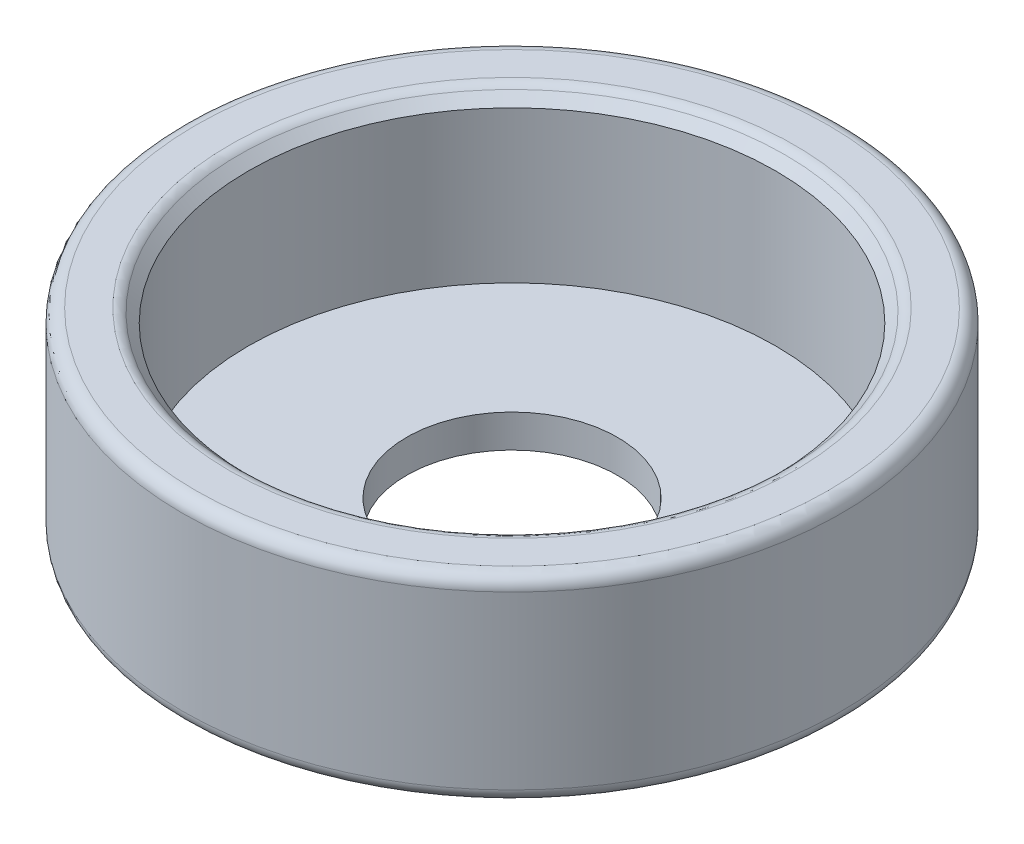
from build123d import *

# Parameters (mm, degrees)
SKETCH1_R           = 5
SKETCH1_R_2         = 1.6
BOSS_EXTRUDE1_DEPTH = 3
SKETCH2_R           = 4
CUT_EXTRUDE1_DEPTH  = 2.5
CHAMFER1_SIZE       = 0.2
FILLET2_R           = 0.2


with BuildPart() as part:
    # Sketch1 → Boss-Extrude1 (new body)
    with BuildSketch(Plane(origin=(0, 0, 0), x_dir=(1, 0, 0), z_dir=(0, 1, 0))):
        with Locations(Location((0, 0, 0), (0, 0, 270))):
            Circle(SKETCH1_R)
        with Locations(Location((0, 0, 0), (0, 0, 270))):
            Circle(SKETCH1_R_2, mode=Mode.SUBTRACT)
    extrude(amount=BOSS_EXTRUDE1_DEPTH)

    # Sketch2 → Cut-Extrude1 (cut)
    with BuildSketch(Plane(origin=(0, 3, 0), x_dir=(1, 0, 0), z_dir=(0, 1, 0))):
        with Locations(Location((0, 0, 0), (0, 0, 270))):
            Circle(SKETCH2_R)
    extrude(amount=-CUT_EXTRUDE1_DEPTH, mode=Mode.SUBTRACT)

    # Chamfer1
    chamfer1_edges = [part.edges().sort_by_distance(p)[0] for p in [
        (0, 3, -4),
    ]]
    chamfer(chamfer1_edges, length=CHAMFER1_SIZE)

    # Fillet2
    fillet2_edges = [part.edges().sort_by_distance(p)[0] for p in [
        (0, 3, -4.2),
        (0, 0, -5),
        (0, 3, -5),
    ]]
    fillet(fillet2_edges, radius=FILLET2_R)


solid = part.part
